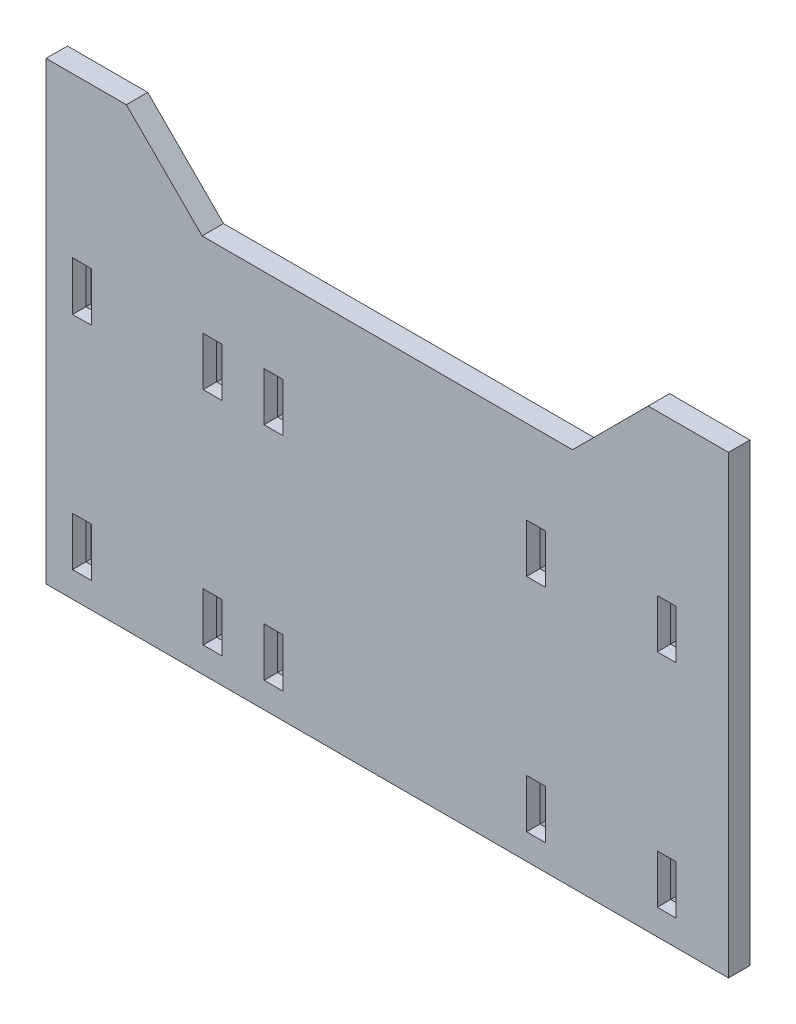
from build123d import *
from OCP.BRepFilletAPI import BRepFilletAPI_MakeChamfer

# Parameters (mm, degrees)
SKETCH1_W           = 127.440194606
SKETCH1_H           = 60
SKETCH1_W_2         = 3.53
SKETCH1_H_2         = 9.11399265
BOSS_EXTRUDE1_DEPTH = 4
BOSS_EXTRUDE2_DEPTH = 4
CHAMFER1_SIZE       = 1.5
CHAMFER1_SIZE2      = 0.5


with BuildPart() as part:
    # Sketch1 → Boss-Extrude1 (new body)
    with BuildSketch(Plane.XY):
        Rectangle(SKETCH1_W, SKETCH1_H)
        with Locations((-32.620097303, 20.65)):
            Rectangle(SKETCH1_W_2, SKETCH1_H_2, mode=Mode.SUBTRACT)
        with Locations((27.7799027, 20.65)):
            Rectangle(SKETCH1_W_2, SKETCH1_H_2, mode=Mode.SUBTRACT)
        with Locations((27.7799027, -20.65)):
            Rectangle(SKETCH1_W_2, SKETCH1_H_2, mode=Mode.SUBTRACT)
        Polygon((-19.455133439, 25.206990566), (-22.985061166, 25.184401952), (-22.999551776, 16.115598048), (-19.440642829, 16.093009434), align=None, mode=Mode.SUBTRACT)
        with Locations((-21.220097303, -20.65)):
            Rectangle(SKETCH1_W_2, SKETCH1_H_2, mode=Mode.SUBTRACT)
        with Locations((52.1799027, 20.65)):
            Rectangle(SKETCH1_W_2, SKETCH1_H_2, mode=Mode.SUBTRACT)
        with Locations((52.1799027, -20.65)):
            Rectangle(SKETCH1_W_2, SKETCH1_H_2, mode=Mode.SUBTRACT)
        with Locations((-32.620097303, -20.65)):
            Rectangle(SKETCH1_W_2, SKETCH1_H_2, mode=Mode.SUBTRACT)
        Polygon((-58.784966326, 25.25), (-55.255228279, 25.206996325), (-55.255228279, 16.093003675), (-58.784966326, 16.05), align=None, mode=Mode.SUBTRACT)
        with Locations((-57.020097303, -20.65)):
            Rectangle(SKETCH1_W_2, SKETCH1_H_2, mode=Mode.SUBTRACT)
    extrude(amount=-BOSS_EXTRUDE1_DEPTH)

    # Sketch2 → Boss-Extrude2 (add)
    with BuildSketch(Plane.XY):
        Polygon((-63.720097303, 30), (-63.720097303, 55), (-48.720097303, 55), (-34.577961679, 40.857864376), (34.577961679, 40.857864376), (48.720097303, 55), (63.720097303, 55), (63.720097303, 30), align=None)
    extrude(amount=-BOSS_EXTRUDE2_DEPTH)

    # Chamfer1: one chamfer whose edges measure the first distance from different faces: ONE call of the kernel's chamfer builder (chamfer() names one face for all edges)
    chamfer1_edges_1 = [part.edges().sort_by_distance(p)[0] for p in [
        (50.4149027, -20.65, -4),
    ]]
    chamfer1_side_1 = [part.faces().sort_by_distance(p)[0] for p in [
        (50.4149027, -20.65, -2),
    ]]
    chamfer1_edges_2 = [part.edges().sort_by_distance(p)[0] for p in [
        (52.1799027, -16.093003675, -4),
    ]]
    chamfer1_side_2 = [part.faces().sort_by_distance(p)[0] for p in [
        (52.1799027, -16.093003675, -2),
    ]]
    chamfer1_edges_3 = [part.edges().sort_by_distance(p)[0] for p in [
        (53.9449027, -20.65, -4),
    ]]
    chamfer1_side_3 = [part.faces().sort_by_distance(p)[0] for p in [
        (53.9449027, -20.65, -2),
    ]]
    chamfer1_edges_4 = [part.edges().sort_by_distance(p)[0] for p in [
        (52.1799027, -25.206996325, -4),
    ]]
    chamfer1_side_4 = [part.faces().sort_by_distance(p)[0] for p in [
        (52.1799027, -25.206996325, -2),
    ]]
    chamfer1_edges_5 = [part.edges().sort_by_distance(p)[0] for p in [
        (-58.784966326, 20.65, -4),
    ]]
    chamfer1_side_5 = [part.faces().sort_by_distance(p)[0] for p in [
        (-58.784966326, 20.65, -2),
    ]]
    chamfer1_edges_6 = [part.edges().sort_by_distance(p)[0] for p in [
        (-57.020097303, 25.228498163, -4),
    ]]
    chamfer1_side_6 = [part.faces().sort_by_distance(p)[0] for p in [
        (-57.020097303, 25.228498163, -2),
    ]]
    chamfer1_edges_7 = [part.edges().sort_by_distance(p)[0] for p in [
        (-55.255228279, 20.65, -4),
    ]]
    chamfer1_side_7 = [part.faces().sort_by_distance(p)[0] for p in [
        (-55.255228279, 20.65, -2),
    ]]
    chamfer1_edges_8 = [part.edges().sort_by_distance(p)[0] for p in [
        (-57.020097303, 16.071501837, -4),
    ]]
    chamfer1_side_8 = [part.faces().sort_by_distance(p)[0] for p in [
        (-57.020097303, 16.071501837, -2),
    ]]
    chamfer1_edges_9 = [part.edges().sort_by_distance(p)[0] for p in [
        (-58.785097303, -20.65, -4),
    ]]
    chamfer1_side_9 = [part.faces().sort_by_distance(p)[0] for p in [
        (-58.785097303, -20.65, -2),
    ]]
    chamfer1_edges_10 = [part.edges().sort_by_distance(p)[0] for p in [
        (-57.020097303, -16.093003675, -4),
    ]]
    chamfer1_side_10 = [part.faces().sort_by_distance(p)[0] for p in [
        (-57.020097303, -16.093003675, -2),
    ]]
    chamfer1_edges_11 = [part.edges().sort_by_distance(p)[0] for p in [
        (-55.255097303, -20.65, -4),
    ]]
    chamfer1_side_11 = [part.faces().sort_by_distance(p)[0] for p in [
        (-55.255097303, -20.65, -2),
    ]]
    chamfer1_edges_12 = [part.edges().sort_by_distance(p)[0] for p in [
        (-57.020097303, -25.206996325, -4),
    ]]
    chamfer1_side_12 = [part.faces().sort_by_distance(p)[0] for p in [
        (-57.020097303, -25.206996325, -2),
    ]]
    chamfer1_edges_13 = [part.edges().sort_by_distance(p)[0] for p in [
        (26.0149027, 20.65, -4),
    ]]
    chamfer1_side_13 = [part.faces().sort_by_distance(p)[0] for p in [
        (26.0149027, 20.65, -2),
    ]]
    chamfer1_edges_14 = [part.edges().sort_by_distance(p)[0] for p in [
        (27.7799027, 25.206996325, -4),
    ]]
    chamfer1_side_14 = [part.faces().sort_by_distance(p)[0] for p in [
        (27.7799027, 25.206996325, -2),
    ]]
    chamfer1_edges_15 = [part.edges().sort_by_distance(p)[0] for p in [
        (29.5449027, 20.65, -4),
    ]]
    chamfer1_side_15 = [part.faces().sort_by_distance(p)[0] for p in [
        (29.5449027, 20.65, -2),
    ]]
    chamfer1_edges_16 = [part.edges().sort_by_distance(p)[0] for p in [
        (27.7799027, 16.093003675, -4),
    ]]
    chamfer1_side_16 = [part.faces().sort_by_distance(p)[0] for p in [
        (27.7799027, 16.093003675, -2),
    ]]
    chamfer1_edges_17 = [part.edges().sort_by_distance(p)[0] for p in [
        (26.0149027, -20.65, -4),
    ]]
    chamfer1_side_17 = [part.faces().sort_by_distance(p)[0] for p in [
        (26.0149027, -20.65, -2),
    ]]
    chamfer1_edges_18 = [part.edges().sort_by_distance(p)[0] for p in [
        (27.7799027, -16.093003675, -4),
    ]]
    chamfer1_side_18 = [part.faces().sort_by_distance(p)[0] for p in [
        (27.7799027, -16.093003675, -2),
    ]]
    chamfer1_edges_19 = [part.edges().sort_by_distance(p)[0] for p in [
        (29.5449027, -20.65, -4),
    ]]
    chamfer1_side_19 = [part.faces().sort_by_distance(p)[0] for p in [
        (29.5449027, -20.65, -2),
    ]]
    chamfer1_edges_20 = [part.edges().sort_by_distance(p)[0] for p in [
        (27.7799027, -25.206996325, -4),
    ]]
    chamfer1_side_20 = [part.faces().sort_by_distance(p)[0] for p in [
        (27.7799027, -25.206996325, -2),
    ]]
    chamfer1_edges_21 = [part.edges().sort_by_distance(p)[0] for p in [
        (-19.447888134, 20.65, -4),
    ]]
    chamfer1_side_21 = [part.faces().sort_by_distance(p)[0] for p in [
        (-19.447888134, 20.65, -2),
    ]]
    chamfer1_edges_22 = [part.edges().sort_by_distance(p)[0] for p in [
        (-21.220097303, 16.104303741, -4),
    ]]
    chamfer1_side_22 = [part.faces().sort_by_distance(p)[0] for p in [
        (-21.220097303, 16.104303741, -2),
    ]]
    chamfer1_edges_23 = [part.edges().sort_by_distance(p)[0] for p in [
        (-22.992306471, 20.65, -4),
    ]]
    chamfer1_side_23 = [part.faces().sort_by_distance(p)[0] for p in [
        (-22.992306471, 20.65, -2),
    ]]
    chamfer1_edges_24 = [part.edges().sort_by_distance(p)[0] for p in [
        (-21.220097303, 25.195696259, -4),
    ]]
    chamfer1_side_24 = [part.faces().sort_by_distance(p)[0] for p in [
        (-21.220097303, 25.195696259, -2),
    ]]
    chamfer1_edges_25 = [part.edges().sort_by_distance(p)[0] for p in [
        (-19.455097303, -20.65, -4),
    ]]
    chamfer1_side_25 = [part.faces().sort_by_distance(p)[0] for p in [
        (-19.455097303, -20.65, -2),
    ]]
    chamfer1_edges_26 = [part.edges().sort_by_distance(p)[0] for p in [
        (-21.220097303, -25.206996325, -4),
    ]]
    chamfer1_side_26 = [part.faces().sort_by_distance(p)[0] for p in [
        (-21.220097303, -25.206996325, -2),
    ]]
    chamfer1_edges_27 = [part.edges().sort_by_distance(p)[0] for p in [
        (-22.985097303, -20.65, -4),
    ]]
    chamfer1_side_27 = [part.faces().sort_by_distance(p)[0] for p in [
        (-22.985097303, -20.65, -2),
    ]]
    chamfer1_edges_28 = [part.edges().sort_by_distance(p)[0] for p in [
        (-21.220097303, -16.093003675, -4),
    ]]
    chamfer1_side_28 = [part.faces().sort_by_distance(p)[0] for p in [
        (-21.220097303, -16.093003675, -2),
    ]]
    chamfer1_edges_29 = [part.edges().sort_by_distance(p)[0] for p in [
        (-34.385097303, 20.65, -4),
    ]]
    chamfer1_side_29 = [part.faces().sort_by_distance(p)[0] for p in [
        (-34.385097303, 20.65, -2),
    ]]
    chamfer1_edges_30 = [part.edges().sort_by_distance(p)[0] for p in [
        (-32.620097303, 25.206996325, -4),
    ]]
    chamfer1_side_30 = [part.faces().sort_by_distance(p)[0] for p in [
        (-32.620097303, 25.206996325, -2),
    ]]
    chamfer1_edges_31 = [part.edges().sort_by_distance(p)[0] for p in [
        (-30.855097303, 20.65, -4),
    ]]
    chamfer1_side_31 = [part.faces().sort_by_distance(p)[0] for p in [
        (-30.855097303, 20.65, -2),
    ]]
    chamfer1_edges_32 = [part.edges().sort_by_distance(p)[0] for p in [
        (-32.620097303, 16.093003675, -4),
    ]]
    chamfer1_side_32 = [part.faces().sort_by_distance(p)[0] for p in [
        (-32.620097303, 16.093003675, -2),
    ]]
    chamfer1_edges_33 = [part.edges().sort_by_distance(p)[0] for p in [
        (-34.385097303, -20.65, -4),
    ]]
    chamfer1_side_33 = [part.faces().sort_by_distance(p)[0] for p in [
        (-34.385097303, -20.65, -2),
    ]]
    chamfer1_edges_34 = [part.edges().sort_by_distance(p)[0] for p in [
        (-32.620097303, -16.093003675, -4),
    ]]
    chamfer1_side_34 = [part.faces().sort_by_distance(p)[0] for p in [
        (-32.620097303, -16.093003675, -2),
    ]]
    chamfer1_edges_35 = [part.edges().sort_by_distance(p)[0] for p in [
        (-30.855097303, -20.65, -4),
    ]]
    chamfer1_side_35 = [part.faces().sort_by_distance(p)[0] for p in [
        (-30.855097303, -20.65, -2),
    ]]
    chamfer1_edges_36 = [part.edges().sort_by_distance(p)[0] for p in [
        (-32.620097303, -25.206996325, -4),
    ]]
    chamfer1_side_36 = [part.faces().sort_by_distance(p)[0] for p in [
        (-32.620097303, -25.206996325, -2),
    ]]
    chamfer1_edges_37 = [part.edges().sort_by_distance(p)[0] for p in [
        (50.4149027, 20.65, -4),
    ]]
    chamfer1_side_37 = [part.faces().sort_by_distance(p)[0] for p in [
        (50.4149027, 20.65, -2),
    ]]
    chamfer1_edges_38 = [part.edges().sort_by_distance(p)[0] for p in [
        (52.1799027, 25.206996325, -4),
    ]]
    chamfer1_side_38 = [part.faces().sort_by_distance(p)[0] for p in [
        (52.1799027, 25.206996325, -2),
    ]]
    chamfer1_edges_39 = [part.edges().sort_by_distance(p)[0] for p in [
        (53.9449027, 20.65, -4),
    ]]
    chamfer1_side_39 = [part.faces().sort_by_distance(p)[0] for p in [
        (53.9449027, 20.65, -2),
    ]]
    chamfer1_edges_40 = [part.edges().sort_by_distance(p)[0] for p in [
        (52.1799027, 16.093003675, -4),
    ]]
    chamfer1_side_40 = [part.faces().sort_by_distance(p)[0] for p in [
        (52.1799027, 16.093003675, -2),
    ]]
    chamfer1 = BRepFilletAPI_MakeChamfer(part.part.solid().wrapped)
    for e in chamfer1_edges_1:
        chamfer1.Add(CHAMFER1_SIZE, CHAMFER1_SIZE2, e.wrapped, chamfer1_side_1[0].wrapped)  # the first distance lies on this face
    for e in chamfer1_edges_2:
        chamfer1.Add(CHAMFER1_SIZE, CHAMFER1_SIZE2, e.wrapped, chamfer1_side_2[0].wrapped)  # the first distance lies on this face
    for e in chamfer1_edges_3:
        chamfer1.Add(CHAMFER1_SIZE, CHAMFER1_SIZE2, e.wrapped, chamfer1_side_3[0].wrapped)  # the first distance lies on this face
    for e in chamfer1_edges_4:
        chamfer1.Add(CHAMFER1_SIZE, CHAMFER1_SIZE2, e.wrapped, chamfer1_side_4[0].wrapped)  # the first distance lies on this face
    for e in chamfer1_edges_5:
        chamfer1.Add(CHAMFER1_SIZE, CHAMFER1_SIZE2, e.wrapped, chamfer1_side_5[0].wrapped)  # the first distance lies on this face
    for e in chamfer1_edges_6:
        chamfer1.Add(CHAMFER1_SIZE, CHAMFER1_SIZE2, e.wrapped, chamfer1_side_6[0].wrapped)  # the first distance lies on this face
    for e in chamfer1_edges_7:
        chamfer1.Add(CHAMFER1_SIZE, CHAMFER1_SIZE2, e.wrapped, chamfer1_side_7[0].wrapped)  # the first distance lies on this face
    for e in chamfer1_edges_8:
        chamfer1.Add(CHAMFER1_SIZE, CHAMFER1_SIZE2, e.wrapped, chamfer1_side_8[0].wrapped)  # the first distance lies on this face
    for e in chamfer1_edges_9:
        chamfer1.Add(CHAMFER1_SIZE, CHAMFER1_SIZE2, e.wrapped, chamfer1_side_9[0].wrapped)  # the first distance lies on this face
    for e in chamfer1_edges_10:
        chamfer1.Add(CHAMFER1_SIZE, CHAMFER1_SIZE2, e.wrapped, chamfer1_side_10[0].wrapped)  # the first distance lies on this face
    for e in chamfer1_edges_11:
        chamfer1.Add(CHAMFER1_SIZE, CHAMFER1_SIZE2, e.wrapped, chamfer1_side_11[0].wrapped)  # the first distance lies on this face
    for e in chamfer1_edges_12:
        chamfer1.Add(CHAMFER1_SIZE, CHAMFER1_SIZE2, e.wrapped, chamfer1_side_12[0].wrapped)  # the first distance lies on this face
    for e in chamfer1_edges_13:
        chamfer1.Add(CHAMFER1_SIZE, CHAMFER1_SIZE2, e.wrapped, chamfer1_side_13[0].wrapped)  # the first distance lies on this face
    for e in chamfer1_edges_14:
        chamfer1.Add(CHAMFER1_SIZE, CHAMFER1_SIZE2, e.wrapped, chamfer1_side_14[0].wrapped)  # the first distance lies on this face
    for e in chamfer1_edges_15:
        chamfer1.Add(CHAMFER1_SIZE, CHAMFER1_SIZE2, e.wrapped, chamfer1_side_15[0].wrapped)  # the first distance lies on this face
    for e in chamfer1_edges_16:
        chamfer1.Add(CHAMFER1_SIZE, CHAMFER1_SIZE2, e.wrapped, chamfer1_side_16[0].wrapped)  # the first distance lies on this face
    for e in chamfer1_edges_17:
        chamfer1.Add(CHAMFER1_SIZE, CHAMFER1_SIZE2, e.wrapped, chamfer1_side_17[0].wrapped)  # the first distance lies on this face
    for e in chamfer1_edges_18:
        chamfer1.Add(CHAMFER1_SIZE, CHAMFER1_SIZE2, e.wrapped, chamfer1_side_18[0].wrapped)  # the first distance lies on this face
    for e in chamfer1_edges_19:
        chamfer1.Add(CHAMFER1_SIZE, CHAMFER1_SIZE2, e.wrapped, chamfer1_side_19[0].wrapped)  # the first distance lies on this face
    for e in chamfer1_edges_20:
        chamfer1.Add(CHAMFER1_SIZE, CHAMFER1_SIZE2, e.wrapped, chamfer1_side_20[0].wrapped)  # the first distance lies on this face
    for e in chamfer1_edges_21:
        chamfer1.Add(CHAMFER1_SIZE, CHAMFER1_SIZE2, e.wrapped, chamfer1_side_21[0].wrapped)  # the first distance lies on this face
    for e in chamfer1_edges_22:
        chamfer1.Add(CHAMFER1_SIZE, CHAMFER1_SIZE2, e.wrapped, chamfer1_side_22[0].wrapped)  # the first distance lies on this face
    for e in chamfer1_edges_23:
        chamfer1.Add(CHAMFER1_SIZE, CHAMFER1_SIZE2, e.wrapped, chamfer1_side_23[0].wrapped)  # the first distance lies on this face
    for e in chamfer1_edges_24:
        chamfer1.Add(CHAMFER1_SIZE, CHAMFER1_SIZE2, e.wrapped, chamfer1_side_24[0].wrapped)  # the first distance lies on this face
    for e in chamfer1_edges_25:
        chamfer1.Add(CHAMFER1_SIZE, CHAMFER1_SIZE2, e.wrapped, chamfer1_side_25[0].wrapped)  # the first distance lies on this face
    for e in chamfer1_edges_26:
        chamfer1.Add(CHAMFER1_SIZE, CHAMFER1_SIZE2, e.wrapped, chamfer1_side_26[0].wrapped)  # the first distance lies on this face
    for e in chamfer1_edges_27:
        chamfer1.Add(CHAMFER1_SIZE, CHAMFER1_SIZE2, e.wrapped, chamfer1_side_27[0].wrapped)  # the first distance lies on this face
    for e in chamfer1_edges_28:
        chamfer1.Add(CHAMFER1_SIZE, CHAMFER1_SIZE2, e.wrapped, chamfer1_side_28[0].wrapped)  # the first distance lies on this face
    for e in chamfer1_edges_29:
        chamfer1.Add(CHAMFER1_SIZE, CHAMFER1_SIZE2, e.wrapped, chamfer1_side_29[0].wrapped)  # the first distance lies on this face
    for e in chamfer1_edges_30:
        chamfer1.Add(CHAMFER1_SIZE, CHAMFER1_SIZE2, e.wrapped, chamfer1_side_30[0].wrapped)  # the first distance lies on this face
    for e in chamfer1_edges_31:
        chamfer1.Add(CHAMFER1_SIZE, CHAMFER1_SIZE2, e.wrapped, chamfer1_side_31[0].wrapped)  # the first distance lies on this face
    for e in chamfer1_edges_32:
        chamfer1.Add(CHAMFER1_SIZE, CHAMFER1_SIZE2, e.wrapped, chamfer1_side_32[0].wrapped)  # the first distance lies on this face
    for e in chamfer1_edges_33:
        chamfer1.Add(CHAMFER1_SIZE, CHAMFER1_SIZE2, e.wrapped, chamfer1_side_33[0].wrapped)  # the first distance lies on this face
    for e in chamfer1_edges_34:
        chamfer1.Add(CHAMFER1_SIZE, CHAMFER1_SIZE2, e.wrapped, chamfer1_side_34[0].wrapped)  # the first distance lies on this face
    for e in chamfer1_edges_35:
        chamfer1.Add(CHAMFER1_SIZE, CHAMFER1_SIZE2, e.wrapped, chamfer1_side_35[0].wrapped)  # the first distance lies on this face
    for e in chamfer1_edges_36:
        chamfer1.Add(CHAMFER1_SIZE, CHAMFER1_SIZE2, e.wrapped, chamfer1_side_36[0].wrapped)  # the first distance lies on this face
    for e in chamfer1_edges_37:
        chamfer1.Add(CHAMFER1_SIZE, CHAMFER1_SIZE2, e.wrapped, chamfer1_side_37[0].wrapped)  # the first distance lies on this face
    for e in chamfer1_edges_38:
        chamfer1.Add(CHAMFER1_SIZE, CHAMFER1_SIZE2, e.wrapped, chamfer1_side_38[0].wrapped)  # the first distance lies on this face
    for e in chamfer1_edges_39:
        chamfer1.Add(CHAMFER1_SIZE, CHAMFER1_SIZE2, e.wrapped, chamfer1_side_39[0].wrapped)  # the first distance lies on this face
    for e in chamfer1_edges_40:
        chamfer1.Add(CHAMFER1_SIZE, CHAMFER1_SIZE2, e.wrapped, chamfer1_side_40[0].wrapped)  # the first distance lies on this face
    add(Compound.cast(chamfer1.Shape()), mode=Mode.REPLACE)


solid = part.part
